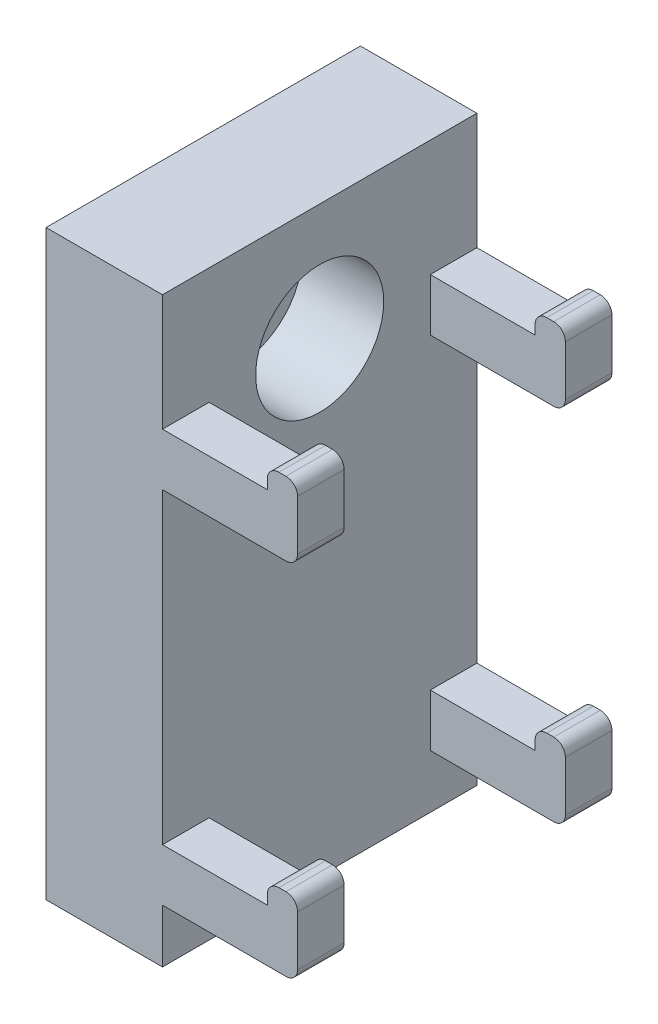
from build123d import *

# Parameters (mm, degrees)
SKETCH1_W           = 27
SKETCH1_H           = 50
BOSS_EXTRUDE1_DEPTH = 10
SKETCH2_R           = 3.5
CUT_EXTRUDE1_DEPTH  = 10
SKETCH3_R           = 5.5
CUT_EXTRUDE2_DEPTH  = 7
BOSS_EXTRUDE2_DEPTH = 4


with BuildPart() as part:
    # Sketch1 → Boss-Extrude1 (new body)
    with BuildSketch(Plane(origin=(0, 0, 0), x_dir=(0, 0, -1), z_dir=(1, 0, 0))):
        with Locations((0, -15)):
            Rectangle(SKETCH1_W, SKETCH1_H)
    extrude(amount=BOSS_EXTRUDE1_DEPTH)

    # Sketch2 → Cut-Extrude1 (cut)
    with BuildSketch(Plane(origin=(10, 0, 0), x_dir=(0, 0, -1), z_dir=(1, 0, 0))):
        Circle(SKETCH2_R)
    extrude(amount=-CUT_EXTRUDE1_DEPTH, mode=Mode.SUBTRACT)

    # Sketch3 → Cut-Extrude2 (cut)
    with BuildSketch(Plane(origin=(10, 0, 0), x_dir=(0, 0, -1), z_dir=(1, 0, 0))):
        Circle(SKETCH3_R)
    extrude(amount=-CUT_EXTRUDE2_DEPTH, mode=Mode.SUBTRACT)

    # Sketch4 → Boss-Extrude2 (add)
    with BuildSketch(Plane.XY.offset(13.5)):
        with BuildLine():
            Line((10, 0), (19, 0))
            Line((19, 0), (19, 0.8))
            ThreePointArc((19, 0.8), (19.292893219, 1.507106781), (20, 1.8))
            Line((20, 1.8), (20.6, 1.8))
            ThreePointArc((20.6, 1.8), (21.307106781, 1.507106781), (21.6, 0.8))
            Line((21.6, 0.8), (21.6, -3.5))
            ThreePointArc((21.6, -3.5), (21.307106781, -4.207106781), (20.6, -4.5))
            Line((20.6, -4.5), (10, -4.5))
            Line((10, -4.5), (10, 0))
        make_face()
        with BuildLine():
            Line((10, -30.9), (19, -30.9))
            Line((19, -30.9), (19, -30.1))
            ThreePointArc((19, -30.1), (19.292893219, -29.392893219), (20, -29.1))
            Line((20, -29.1), (20.6, -29.1))
            ThreePointArc((20.6, -29.1), (21.307106781, -29.392893219), (21.6, -30.1))
            Line((21.6, -30.1), (21.6, -34.4))
            ThreePointArc((21.6, -34.4), (21.307106781, -35.107106781), (20.6, -35.4))
            Line((20.6, -35.4), (10, -35.4))
            Line((10, -35.4), (10, -30.9))
        make_face()
    boss_extrude2 = extrude(amount=-BOSS_EXTRUDE2_DEPTH)

    # Mirror1: Boss-Extrude2 across plane
    add(boss_extrude2.mirror(Plane.XY))


solid = part.part
